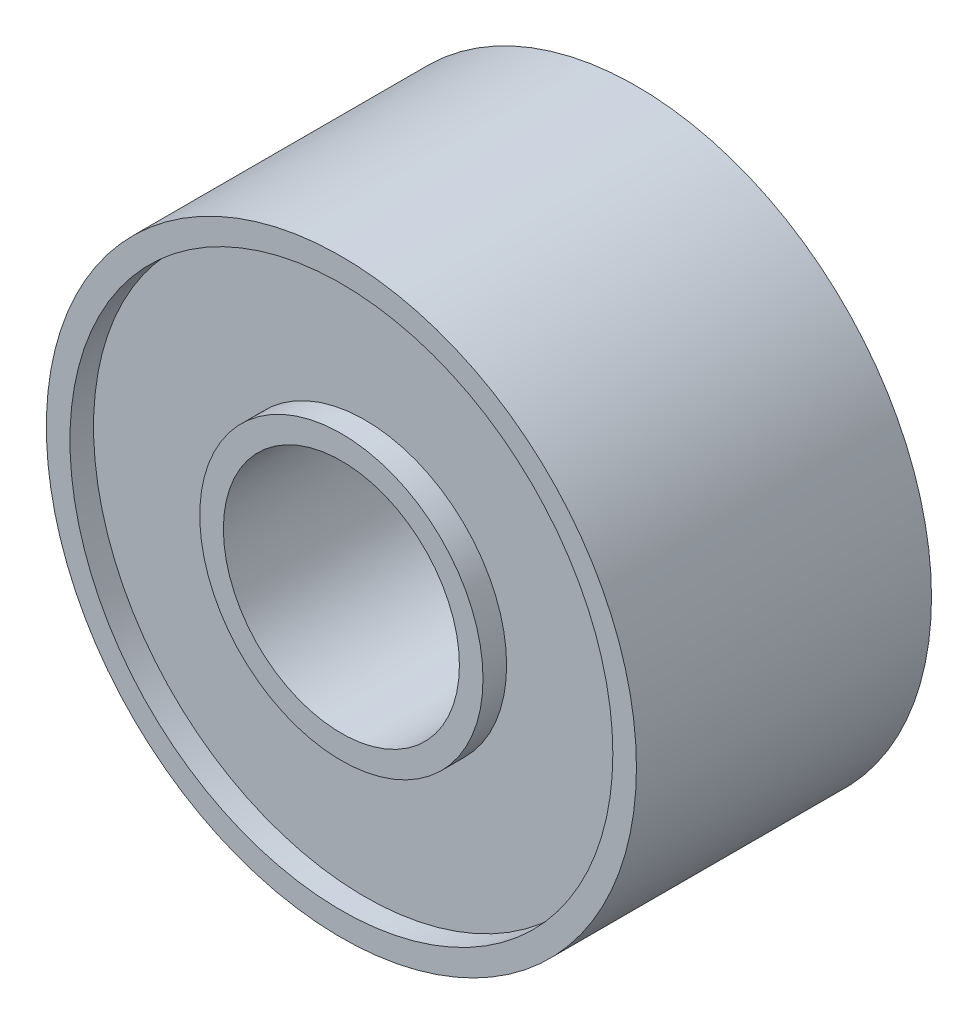
from build123d import *

# Parameters (mm, degrees)
EXTRUDE_1_DEPTH      = 1.25
EXTRUDE_1_DEPTH_BACK = 1.25
SKETCH_1_R           = 2.5
SKETCH_1_R_2         = 1
SKETCH_2_R           = 2.3
SKETCH_2_R_2         = 1.2
CUT_EXTRUDE_1_DEPTH  = 0.2


with BuildPart() as part:
    # 草图1 → 凸台-拉伸1 (new, two sides: drawn at the far end of the back side and taken through both)
    with BuildSketch(Plane.XY.offset(-EXTRUDE_1_DEPTH_BACK)):
        Circle(SKETCH_1_R)
        Circle(SKETCH_1_R_2, mode=Mode.SUBTRACT)
    extrude(amount=EXTRUDE_1_DEPTH + EXTRUDE_1_DEPTH_BACK)

    # 草图2 → 切除-拉伸1 (cut)
    with BuildSketch(Plane.XY.offset(1.25)):
        Circle(SKETCH_2_R)
        Circle(SKETCH_2_R_2, mode=Mode.SUBTRACT)
    cut_extrude_1 = extrude(amount=-CUT_EXTRUDE_1_DEPTH, mode=Mode.SUBTRACT)

    # 镜向1: 切除-拉伸1 across plane
    add(cut_extrude_1.mirror(Plane.XY), mode=Mode.SUBTRACT)


solid = part.part
